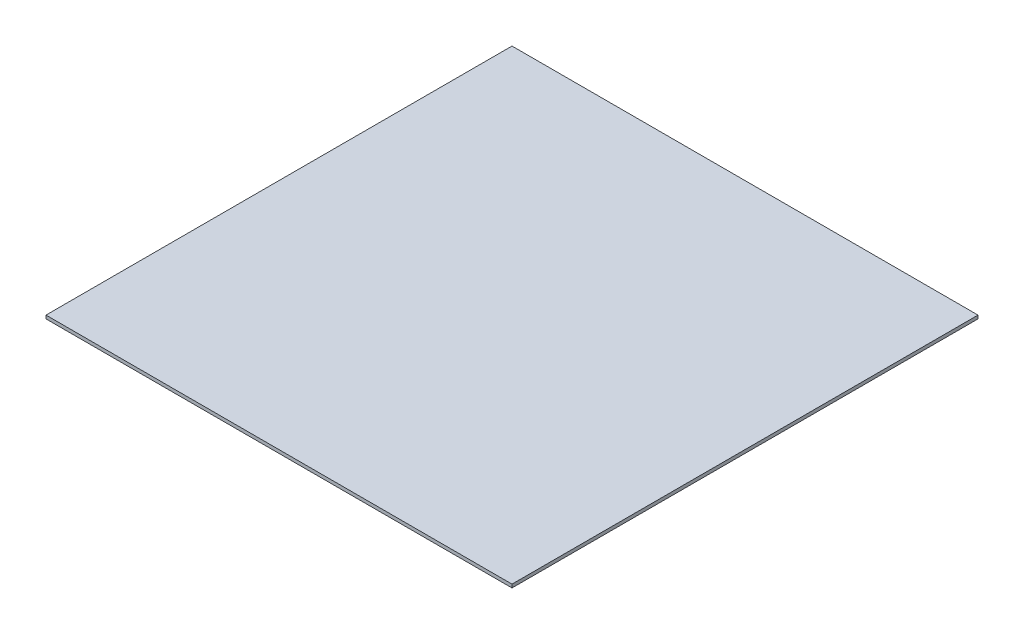
from build123d import *

# Parameters (mm, degrees)
SKETCH1_W           = 139.7
SKETCH1_H           = 139.7
BOSS_EXTRUDE1_DEPTH = 1


with BuildPart() as part:
    # Sketch1 → Boss-Extrude1 (new body)
    with BuildSketch(Plane(origin=(0, 0, 0), x_dir=(1, 0, 0), z_dir=(0, 1, 0))):
        Rectangle(SKETCH1_W, SKETCH1_H)
    extrude(amount=BOSS_EXTRUDE1_DEPTH)


solid = part.part
